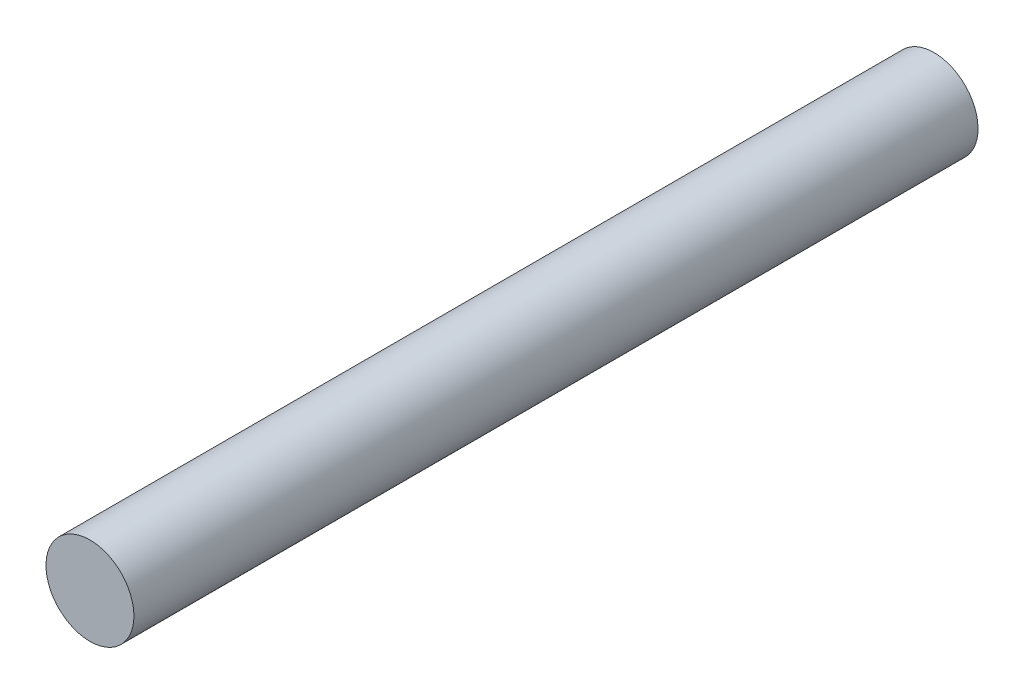
from build123d import *

# Parameters (mm, degrees)
SKETCH2_R           = 19.05
BOSS_EXTRUDE1_DEPTH = 182.88


with BuildPart() as part:
    # Sketch2 → Boss-Extrude1 (new, symmetric)
    with BuildSketch(Plane(origin=(-89.743083245, 20.594922527, 187.198), x_dir=(-0.9717747194470234, -0.2359107768705339, 0), z_dir=(0, 0, -1))):
        with Locations(Location((236.361174504, 72.898, 0), (0, 0, 283.645316024))):
            Circle(SKETCH2_R)
    extrude(amount=BOSS_EXTRUDE1_DEPTH, both=True)


solid = part.part
